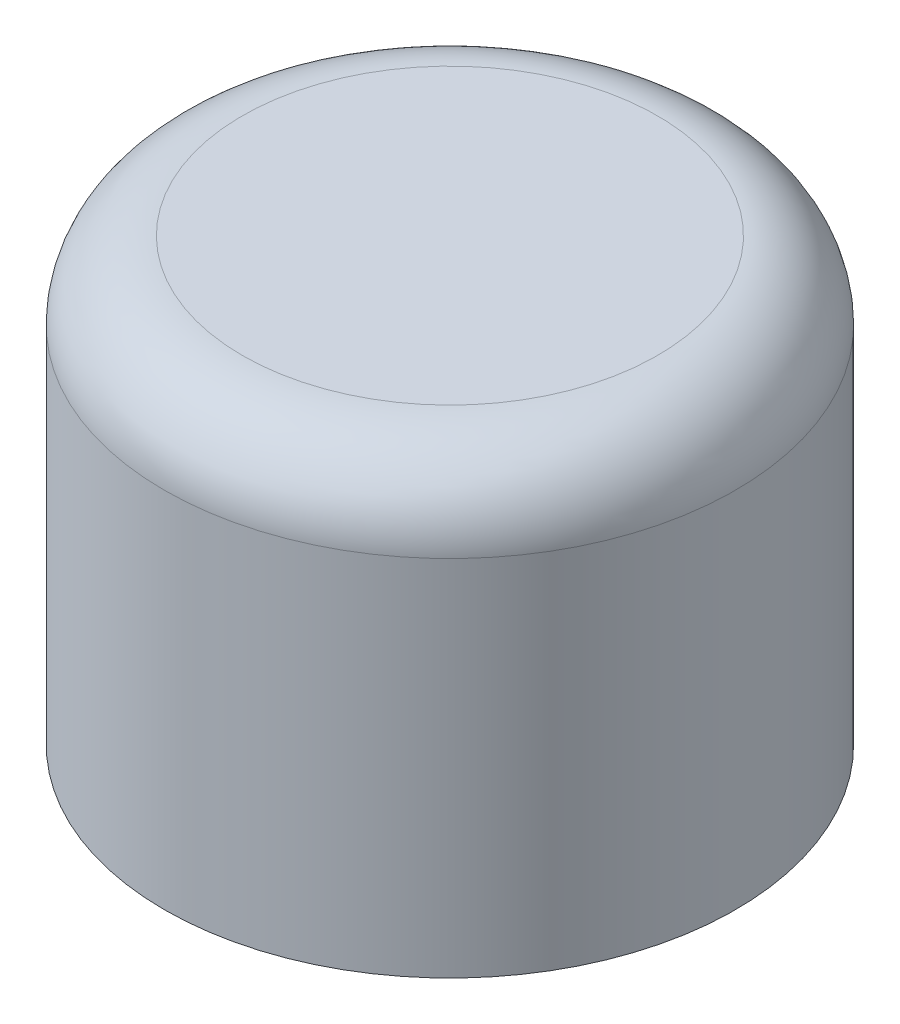
from build123d import *

# Parameters (mm, degrees)
SKETCH1_R           = 5.5
BOSS_EXTRUDE1_DEPTH = 8.5
FILLET1_R           = 1.5
SHELL1_T            = -2


with BuildPart() as part:
    # Sketch1 → Boss-Extrude1 (new body)
    with BuildSketch(Plane(origin=(0, 0, 0), x_dir=(1, 0, 0), z_dir=(0, 1, 0))):
        with Locations(Location((0, 0, 0), (0, 0, 270))):
            Circle(SKETCH1_R)
    extrude(amount=BOSS_EXTRUDE1_DEPTH)

    # Fillet1
    fillet1_edges = [part.edges().sort_by_distance(p)[0] for p in [
        (0, 8.5, -5.5),
    ]]
    fillet(fillet1_edges, radius=FILLET1_R)

    # Shell1
    shell1_openings = [part.faces().sort_by_distance(p)[0] for p in [
        (0, 0, 0),
    ]]
    offset(amount=SHELL1_T, openings=shell1_openings, kind=Kind.INTERSECTION)


solid = part.part
